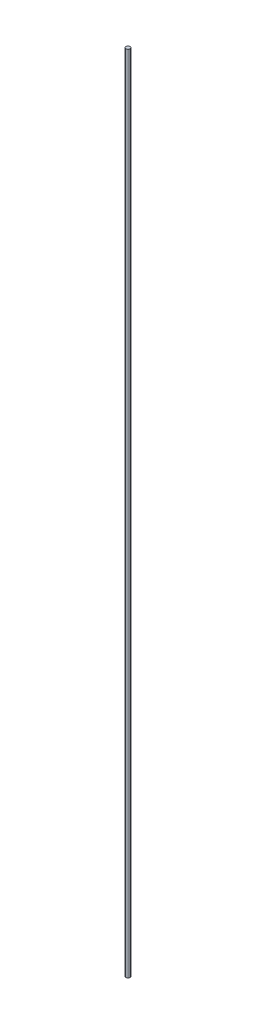
from build123d import *

# Parameters (mm, degrees)
SKETCH2_R           = 3.175
BOSS_EXTRUDE1_DEPTH = 1270


with BuildPart() as part:
    # Sketch2 → Boss-Extrude1 (new body)
    with BuildSketch(Plane(origin=(0, 0, 0), x_dir=(1, 0, 0), z_dir=(0, 1, 0))):
        with Locations(Location((0, 0, 0), (0, 0, 90))):
            Circle(SKETCH2_R)
    extrude(amount=BOSS_EXTRUDE1_DEPTH)


solid = part.part
